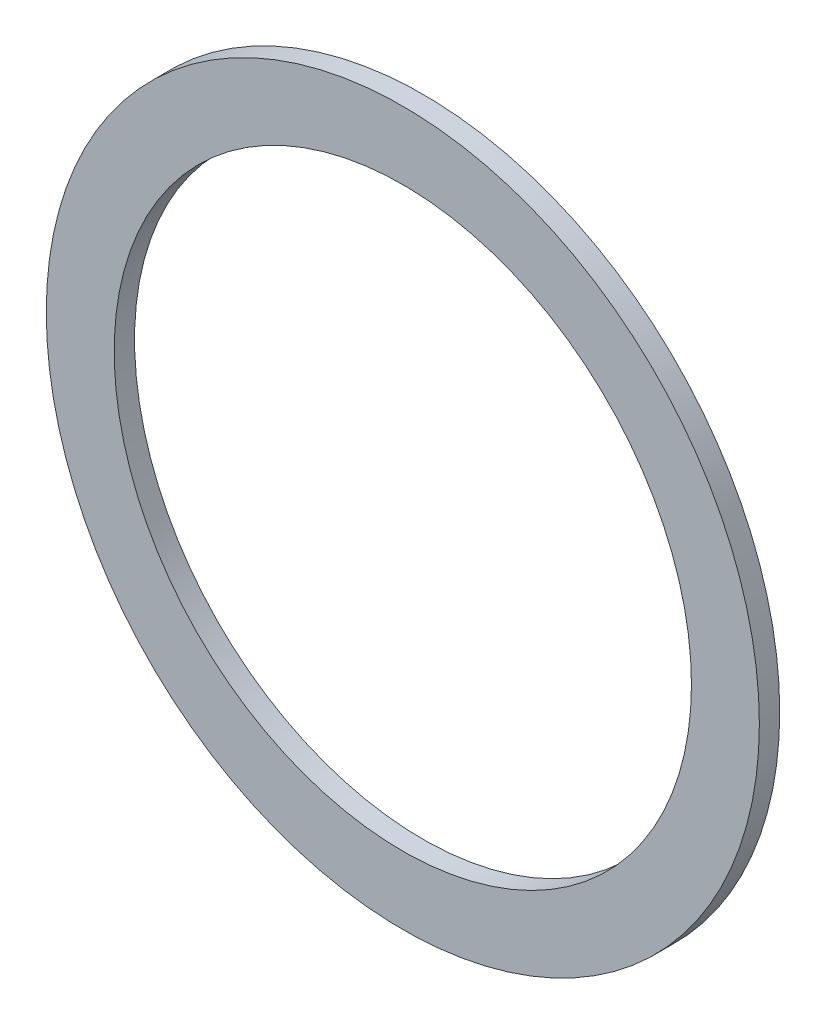
from build123d import *

# Parameters (mm, degrees)
SKETCH_1_R      = 1.05
SKETCH_1_R_2    = 0.85
EXTRUDE_1_DEPTH = 0.06


with BuildPart() as part:
    # 草圖1 → 填料-伸長1 (new body)
    with BuildSketch(Plane.XY):
        Circle(SKETCH_1_R)
        Circle(SKETCH_1_R_2, mode=Mode.SUBTRACT)
    extrude(amount=EXTRUDE_1_DEPTH)


solid = part.part
